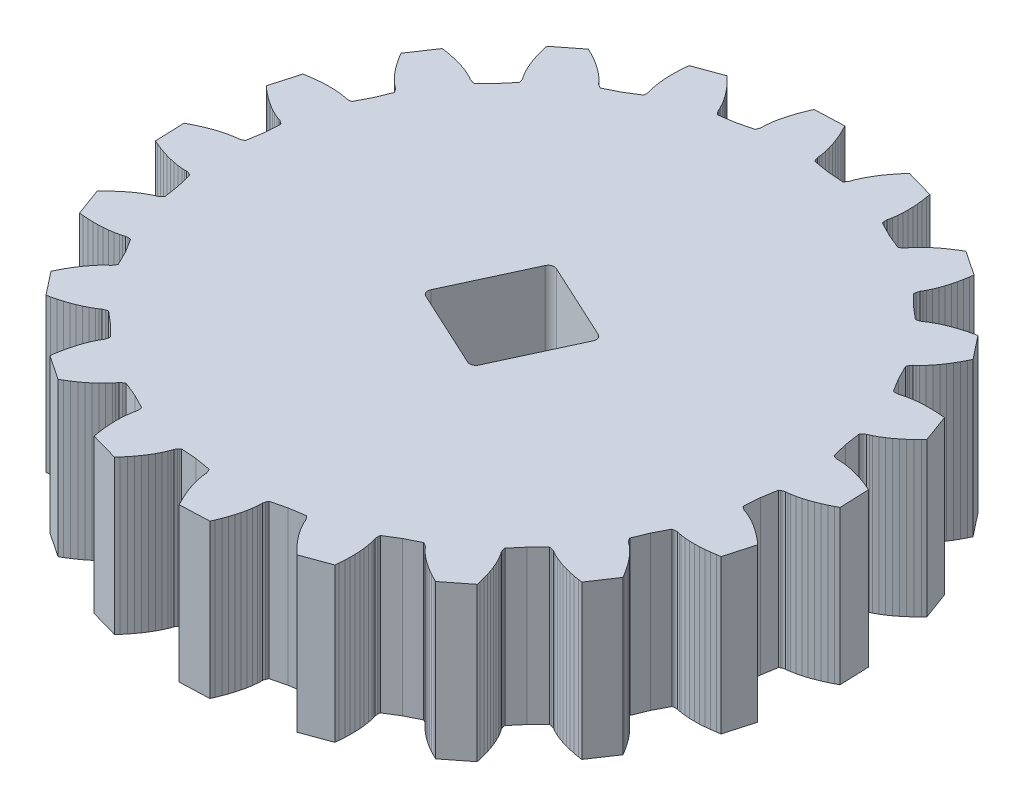
from build123d import *

# Parameters (mm, degrees)
BOSS_EXTRUDE2_DEPTH = 5
CUT_EXTRUDE1_DEPTH  = 31.823823902


with BuildPart() as part:
    # Sketch5 → Boss-Extrude2 (new body)
    with BuildSketch(Plane(origin=(0, 0, 0), x_dir=(1, 0, 0), z_dir=(0, 1, 0))):
        Polygon((19.93419, 9.65246), (19.89596, 9.13765), (19.92824, 9.10402), (19.96194, 9.07861), (20.03044, 9.03435), (20.10281, 9.01127), (20.1744, 8.98412), (20.31581, 8.92081), (20.45517, 8.84772), (20.59264, 8.76627), (20.72826, 8.67728), (20.86203, 8.58132), (20.99391, 8.4788), (21.12387, 8.37003), (21.22002, 8.2845), (20.95722, 7.35825), (20.83048, 7.33597), (20.66276, 7.31165), (20.49669, 7.29367), (20.33246, 7.28226), (20.17031, 7.27776), (20.01055, 7.28064), (19.85357, 7.29163), (19.69998, 7.31201), (19.62479, 7.32651), (19.55109, 7.34487), (19.46955, 7.34318), (19.42753, 7.33926), (19.38239, 7.32759), (19.14457, 6.86942), (18.94913, 6.39162), (18.96943, 6.34966), (18.99363, 6.31508), (19.0451, 6.25182), (19.1068, 6.20751), (19.1665, 6.15956), (19.28142, 6.05565), (19.39137, 5.94307), (19.49694, 5.82313), (19.59843, 5.69659), (19.696, 5.56399), (19.78975, 5.42573), (19.87973, 5.28213), (19.94475, 5.17107), (19.40858, 4.37136), (19.28115, 4.38934), (19.11414, 4.41804), (18.95063, 4.45225), (18.79091, 4.49216), (18.63531, 4.53798), (18.48426, 4.59009), (18.33836, 4.64905), (18.19859, 4.7159), (18.13156, 4.75292), (18.06714, 4.79316), (17.98907, 4.81675), (17.94789, 4.826), (17.90136, 4.82885), (17.53359, 4.46659), (17.20007, 4.07258), (17.20641, 4.0264), (17.21874, 3.98603), (17.24814, 3.90996), (17.29313, 3.84876), (17.33509, 3.78471), (17.41227, 3.65037), (17.48206, 3.50932), (17.5454, 3.36262), (17.60281, 3.21092), (17.65463, 3.05466), (17.70107, 2.8942), (17.74227, 2.72981), (17.76979, 2.6041), (17.01274, 2.00922), (16.8971, 2.06569), (16.74713, 2.1446), (16.6022, 2.22767), (16.46263, 2.31497), (16.3288, 2.40664), (16.20125, 2.50287), (16.08071, 2.60403), (15.96843, 2.7108), (15.91612, 2.76672), (15.86729, 2.8249), (15.80033, 2.87146), (15.76403, 2.89299), (15.72066, 2.91007), (15.25894, 2.67919), (14.81999, 2.40753), (14.81175, 2.36165), (14.811, 2.31945), (14.81546, 2.23802), (14.83933, 2.1659), (14.85944, 2.09202), (14.89134, 1.94041), (14.91412, 1.7847), (14.92903, 1.62561), (14.93675, 1.46358), (14.93775, 1.29896), (14.93233, 1.132), (14.92071, 0.96293), (14.90804, 0.83487), (14.00421, 0.50304), (13.91169, 0.59248), (13.79344, 0.71387), (13.68127, 0.83766), (13.57551, 0.96382), (13.47656, 1.09236), (13.38499, 1.2233), (13.30161, 1.35676), (13.22782, 1.493), (13.19535, 1.56234), (13.16689, 1.63277), (13.11759, 1.69774), (13.08972, 1.72943), (13.05375, 1.75908), (12.54329, 1.68218), (12.04187, 1.55946), (12.01986, 1.51836), (12.00611, 1.47846), (11.98518, 1.39964), (11.98559, 1.32368), (11.9819, 1.2472), (11.96538, 1.09315), (11.93893, 0.93802), (11.90394, 0.78211), (11.86122, 0.62563), (11.8113, 0.46875), (11.75455, 0.31164), (11.69126, 0.15444), (11.63964, 0.03656), (10.6775, 0.00027), (10.61715, 0.11393), (10.54219, 0.26592), (10.47377, 0.41831), (10.41217, 0.57098), (10.35779, 0.72379), (10.31115, 0.87663), (10.2731, 1.02932), (10.24502, 1.18169), (10.23557, 1.25768), (10.23026, 1.33345), (10.20346, 1.41047), (10.18674, 1.44922), (10.1617, 1.48854), (9.65246, 1.57315), (9.13765, 1.61138), (9.10402, 1.5791), (9.07861, 1.5454), (9.03435, 1.4769), (9.01127, 1.40453), (8.98412, 1.33294), (8.92081, 1.19153), (8.84772, 1.05217), (8.76627, 0.9147), (8.67728, 0.77908), (8.58132, 0.64531), (8.4788, 0.51342), (8.37003, 0.38347), (8.2845, 0.28731), (7.35825, 0.55011), (7.33597, 0.67686), (7.31165, 0.84457), (7.29367, 1.01065), (7.28226, 1.17488), (7.27776, 1.33703), (7.28064, 1.49679), (7.29163, 1.65377), (7.31201, 1.80736), (7.32651, 1.88254), (7.34487, 1.95625), (7.34318, 2.03779), (7.33926, 2.07981), (7.32759, 2.12494), (6.86942, 2.36277), (6.39162, 2.55821), (6.34966, 2.5379), (6.31508, 2.5137), (6.25182, 2.46223), (6.20751, 2.40054), (6.15956, 2.34084), (6.05565, 2.22592), (5.94307, 2.11596), (5.82313, 2.01039), (5.69659, 1.90891), (5.56399, 1.81134), (5.42573, 1.71759), (5.28213, 1.62761), (5.17107, 1.56259), (4.37136, 2.09875), (4.38934, 2.22618), (4.41804, 2.3932), (4.45225, 2.5567), (4.49216, 2.71642), (4.53798, 2.87202), (4.59009, 3.02308), (4.64905, 3.16898), (4.7159, 3.30875), (4.75292, 3.37578), (4.79316, 3.4402), (4.81675, 3.51827), (4.826, 3.55945), (4.82885, 3.60598), (4.46659, 3.97375), (4.07258, 4.30727), (4.0264, 4.30093), (3.98603, 4.28859), (3.90996, 4.25919), (3.84876, 4.21421), (3.78471, 4.17225), (3.65037, 4.09506), (3.50932, 4.02528), (3.36262, 3.96194), (3.21092, 3.90453), (3.05466, 3.85271), (2.8942, 3.80627), (2.72981, 3.76507), (2.6041, 3.73755), (2.00922, 4.4946), (2.06569, 4.61023), (2.1446, 4.76021), (2.22767, 4.90514), (2.31497, 5.04471), (2.40664, 5.17853), (2.50287, 5.30609), (2.60403, 5.42663), (2.7108, 5.5389), (2.76672, 5.59121), (2.8249, 5.64005), (2.87146, 5.707), (2.89299, 5.7433), (2.91007, 5.78668), (2.67919, 6.24839), (2.40753, 6.68735), (2.36165, 6.69559), (2.31945, 6.69633), (2.23802, 6.69188), (2.1659, 6.66801), (2.09202, 6.64789), (1.94041, 6.616), (1.7847, 6.59321), (1.62561, 6.57831), (1.46358, 6.57058), (1.29896, 6.56959), (1.132, 6.57501), (0.96293, 6.58662), (0.83487, 6.59929), (0.50304, 7.50312), (0.59248, 7.59565), (0.71387, 7.7139), (0.83766, 7.82606), (0.96382, 7.93183), (1.09236, 8.03077), (1.2233, 8.12235), (1.35676, 8.20573), (1.493, 8.27952), (1.56234, 8.31198), (1.63277, 8.34045), (1.69774, 8.38974), (1.72943, 8.41761), (1.75908, 8.45359), (1.68218, 8.96405), (1.55946, 9.46547), (1.51836, 9.48748), (1.47846, 9.50123), (1.39964, 9.52216), (1.32368, 9.52174), (1.2472, 9.52544), (1.09315, 9.54196), (0.93802, 9.56841), (0.78211, 9.60339), (0.62563, 9.64611), (0.46875, 9.69604), (0.31164, 9.75279), (0.15444, 9.81608), (0.03656, 9.8677), (0.00027, 10.82983), (0.11393, 10.89019), (0.26592, 10.96514), (0.41831, 11.03357), (0.57098, 11.09516), (0.72379, 11.14955), (0.87663, 11.19618), (1.02932, 11.23424), (1.18169, 11.26231), (1.25768, 11.27176), (1.33345, 11.27707), (1.41047, 11.30388), (1.44922, 11.32059), (1.48854, 11.34564), (1.57315, 11.85488), (1.61138, 12.36968), (1.5791, 12.40332), (1.5454, 12.42872), (1.4769, 12.47298), (1.40453, 12.49606), (1.33294, 12.52321), (1.19153, 12.58653), (1.05217, 12.65962), (0.9147, 12.74107), (0.77908, 12.83006), (0.64531, 12.92601), (0.51342, 13.02854), (0.38347, 13.13731), (0.28731, 13.22283), (0.55011, 14.14909), (0.67686, 14.17137), (0.84457, 14.19569), (1.01065, 14.21367), (1.17488, 14.22508), (1.33703, 14.22958), (1.49679, 14.2267), (1.65377, 14.21571), (1.80736, 14.19532), (1.88254, 14.18083), (1.95625, 14.16246), (2.03779, 14.16415), (2.07981, 14.16808), (2.12494, 14.17975), (2.36277, 14.63792), (2.55821, 15.11571), (2.5379, 15.15768), (2.5137, 15.19225), (2.46223, 15.25551), (2.40054, 15.29983), (2.34084, 15.34777), (2.22592, 15.45169), (2.11596, 15.56426), (2.01039, 15.68421), (1.90891, 15.81075), (1.81134, 15.94335), (1.71759, 16.08161), (1.62761, 16.22521), (1.56259, 16.33626), (2.09875, 17.13598), (2.22618, 17.118), (2.3932, 17.0893), (2.5567, 17.05508), (2.71642, 17.01518), (2.87202, 16.96936), (3.02308, 16.91725), (3.16898, 16.85829), (3.30875, 16.79144), (3.37578, 16.75442), (3.4402, 16.71418), (3.51827, 16.69059), (3.55945, 16.68133), (3.60598, 16.67849), (3.97375, 17.04074), (4.30727, 17.43475), (4.30093, 17.48094), (4.28859, 17.5213), (4.25919, 17.59737), (4.21421, 17.65858), (4.17225, 17.72263), (4.09506, 17.85697), (4.02528, 17.99801), (3.96194, 18.14471), (3.90453, 18.29642), (3.85271, 18.45268), (3.80627, 18.61314), (3.76507, 18.77752), (3.73755, 18.90323), (4.4946, 19.49812), (4.61023, 19.44165), (4.76021, 19.36274), (4.90514, 19.27967), (5.04471, 19.19237), (5.17853, 19.1007), (5.30609, 19.00447), (5.42663, 18.9033), (5.5389, 18.79654), (5.59121, 18.74062), (5.64005, 18.68244), (5.707, 18.63588), (5.7433, 18.61435), (5.78668, 18.59726), (6.24839, 18.82814), (6.68735, 19.0998), (6.69559, 19.14569), (6.69633, 19.18789), (6.69188, 19.26932), (6.66801, 19.34143), (6.64789, 19.41531), (6.616, 19.56693), (6.59321, 19.72264), (6.57831, 19.88173), (6.57058, 20.04375), (6.56959, 20.20838), (6.57501, 20.37534), (6.58662, 20.5444), (6.59929, 20.67247), (7.50312, 21.00429), (7.59565, 20.91485), (7.7139, 20.79346), (7.82606, 20.66967), (7.93183, 20.54351), (8.03077, 20.41498), (8.12235, 20.28404), (8.20573, 20.15058), (8.27952, 20.01434), (8.31198, 19.94499), (8.34045, 19.87457), (8.38974, 19.8096), (8.41761, 19.77791), (8.45359, 19.74825), (8.96405, 19.82516), (9.46547, 19.94788), (9.48748, 19.98897), (9.50123, 20.02887), (9.52216, 20.1077), (9.52174, 20.18366), (9.52544, 20.26014), (9.54196, 20.41419), (9.56841, 20.56932), (9.60339, 20.72523), (9.64611, 20.88171), (9.69604, 21.03858), (9.75279, 21.19569), (9.81608, 21.3529), (9.8677, 21.47078), (10.82983, 21.50707), (10.89019, 21.39341), (10.96514, 21.24142), (11.03357, 21.08903), (11.09516, 20.93636), (11.14955, 20.78354), (11.19618, 20.63071), (11.23424, 20.47802), (11.26231, 20.32565), (11.27176, 20.24966), (11.27707, 20.17389), (11.30388, 20.09686), (11.32059, 20.05811), (11.34564, 20.01879), (11.85488, 19.93419), (12.36968, 19.89596), (12.40332, 19.92824), (12.42872, 19.96194), (12.47298, 20.03044), (12.49606, 20.10281), (12.52321, 20.1744), (12.58653, 20.31581), (12.65962, 20.45517), (12.74107, 20.59264), (12.83006, 20.72826), (12.92601, 20.86203), (13.02854, 20.99391), (13.13731, 21.12387), (13.22283, 21.22002), (14.14909, 20.95722), (14.17137, 20.83048), (14.19569, 20.66276), (14.21367, 20.49669), (14.22508, 20.33246), (14.22958, 20.17031), (14.2267, 20.01055), (14.21571, 19.85357), (14.19532, 19.69998), (14.18083, 19.62479), (14.16246, 19.55109), (14.16415, 19.46955), (14.16808, 19.42753), (14.17975, 19.38239), (14.63792, 19.14457), (15.11571, 18.94913), (15.15768, 18.96943), (15.19225, 18.99363), (15.25551, 19.0451), (15.29983, 19.1068), (15.34777, 19.1665), (15.45169, 19.28142), (15.56426, 19.39137), (15.68421, 19.49694), (15.81075, 19.59843), (15.94335, 19.696), (16.08161, 19.78975), (16.22521, 19.87973), (16.33626, 19.94475), (17.13598, 19.40858), (17.118, 19.28115), (17.0893, 19.11414), (17.05508, 18.95063), (17.01518, 18.79091), (16.96936, 18.63531), (16.91725, 18.48426), (16.85829, 18.33836), (16.79144, 18.19859), (16.75442, 18.13156), (16.71418, 18.06714), (16.69059, 17.98907), (16.68133, 17.94789), (16.67849, 17.90136), (17.04074, 17.53359), (17.43475, 17.20007), (17.48094, 17.20641), (17.5213, 17.21874), (17.59737, 17.24814), (17.65858, 17.29313), (17.72263, 17.33509), (17.85697, 17.41227), (17.99801, 17.48206), (18.14471, 17.5454), (18.29642, 17.60281), (18.45268, 17.65463), (18.61314, 17.70107), (18.77752, 17.74227), (18.90323, 17.76979), (19.49812, 17.01274), (19.44165, 16.8971), (19.36274, 16.74713), (19.27967, 16.6022), (19.19237, 16.46263), (19.1007, 16.3288), (19.00447, 16.20125), (18.9033, 16.08071), (18.79654, 15.96843), (18.74062, 15.91612), (18.68244, 15.86729), (18.63588, 15.80033), (18.61435, 15.76403), (18.59726, 15.72066), (18.82814, 15.25894), (19.0998, 14.81999), (19.14569, 14.81175), (19.18789, 14.811), (19.26932, 14.81546), (19.34143, 14.83933), (19.41531, 14.85944), (19.56693, 14.89134), (19.72264, 14.91412), (19.88173, 14.92903), (20.04375, 14.93675), (20.20838, 14.93775), (20.37534, 14.93233), (20.5444, 14.92071), (20.67247, 14.90804), (21.00429, 14.00421), (20.91485, 13.91169), (20.79346, 13.79344), (20.66967, 13.68127), (20.54351, 13.57551), (20.41498, 13.47656), (20.28404, 13.38499), (20.15058, 13.30161), (20.01434, 13.22782), (19.94499, 13.19535), (19.87457, 13.16689), (19.8096, 13.11759), (19.77791, 13.08972), (19.74825, 13.05375), (19.82516, 12.54329), (19.94788, 12.04187), (19.98897, 12.01986), (20.02887, 12.00611), (20.1077, 11.98518), (20.18366, 11.98559), (20.26014, 11.9819), (20.41419, 11.96538), (20.56932, 11.93893), (20.72523, 11.90394), (20.88171, 11.86122), (21.03858, 11.8113), (21.19569, 11.75455), (21.3529, 11.69126), (21.47078, 11.63964), (21.50707, 10.6775), (21.39341, 10.61715), (21.24142, 10.54219), (21.08903, 10.47377), (20.93636, 10.41217), (20.78354, 10.35779), (20.63071, 10.31115), (20.47802, 10.2731), (20.32565, 10.24502), (20.24966, 10.23557), (20.17389, 10.23026), (20.09686, 10.20346), (20.05811, 10.18674), (20.01879, 10.1617), align=None)
    extrude(amount=BOSS_EXTRUDE2_DEPTH)

    # Sketch7 → Cut-Extrude1 (cut, through all)
    with BuildSketch(Plane.XZ):
        with BuildLine():
            Line((11.352006246, -8.713572484), (8.811049884, -9.88981258))
            ThreePointArc((8.811049884, -9.88981258), (8.70732026, -10.002380882), (8.71357015, -10.155326612))
            Line((8.71357015, -10.155326612), (9.889810246, -12.696282975))
            ThreePointArc((9.889810246, -12.696282975), (10.002378548, -12.800012599), (10.155324278, -12.793762709))
            Line((10.155324278, -12.793762709), (12.696280641, -11.617522613))
            ThreePointArc((12.696280641, -11.617522613), (12.800010265, -11.50495431), (12.793760375, -11.35200858))
            Line((12.793760375, -11.35200858), (11.617520279, -8.811052217))
            ThreePointArc((11.617520279, -8.811052217), (11.504951977, -8.707322594), (11.352006246, -8.713572484))
        make_face()
    extrude(amount=-CUT_EXTRUDE1_DEPTH, mode=Mode.SUBTRACT)


solid = part.part
